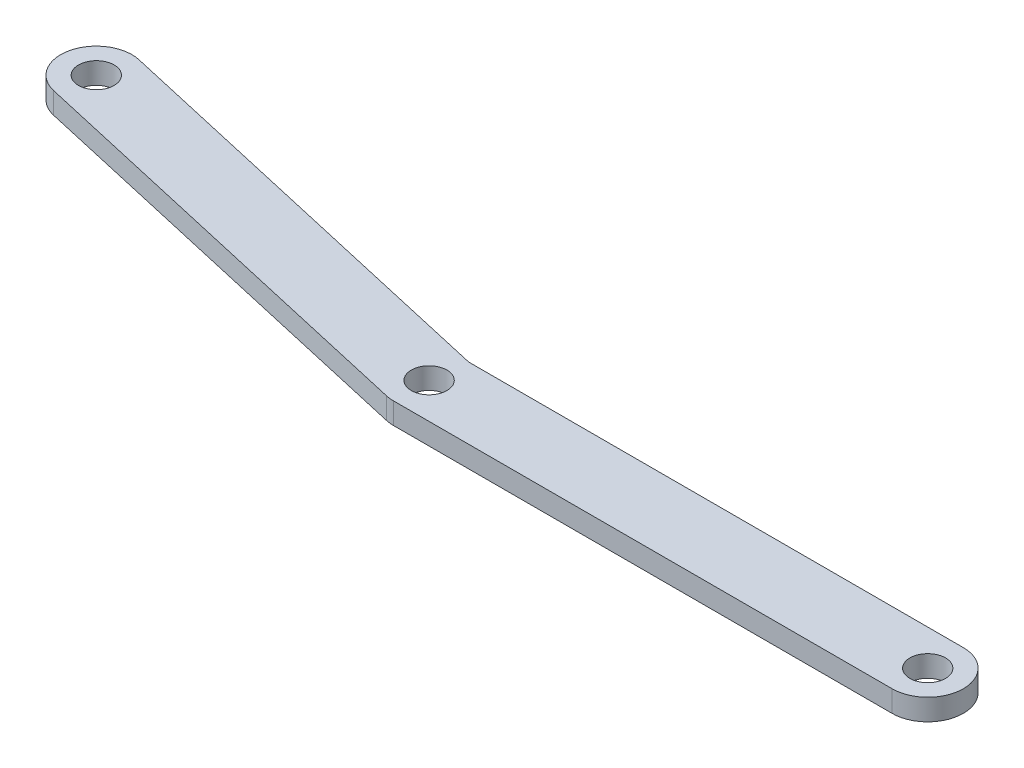
from build123d import *

# Parameters (mm, degrees)
SKETCH2_R               = 3.175
BOSS_EXTRUDE2_DEPTH     = 3.81
SKETCH1_R               = 3.175
BOSS_EXTRUDE3_DEPTH     = 3.81
CUT_EXTRUDE1_DEPTH      = 130.839106153
CUT_EXTRUDE1_DEPTH_BACK = 130.839106153
SKETCH3_R               = 3.175


with BuildPart() as part:
    # Sketch2 → Boss-Extrude2 (new body)
    with BuildSketch(Plane(origin=(0, 0, 0), x_dir=(1, 0, 0), z_dir=(0, 1, 0))):
        with BuildLine():
            Line((-45.85683296, -6.1921984), (-122.640093118, 11.252530303))
            ThreePointArc((-122.640093118, 11.252530303), (-127.425458558, 18.851561662), (-119.826427198, 23.636927102))
            Line((-119.826427198, 23.636927102), (-43.04316704, 6.1921984))
            ThreePointArc((-43.04316704, 6.1921984), (-38.2578016, -1.40683296), (-45.85683296, -6.1921984))
        make_face()
        with Locations(Location((-121.233260158, 17.444728703, 0), (0, 0, 90))):
            Circle(SKETCH2_R, mode=Mode.SUBTRACT)
    extrude(amount=BOSS_EXTRUDE2_DEPTH)

    # Sketch1 → Boss-Extrude3 (add)
    with BuildSketch(Plane(origin=(0, 0, 0), x_dir=(1, 0, 0), z_dir=(0, 1, 0))):
        with BuildLine():
            Line((-44.45, 6.35), (44.45, 6.35))
            ThreePointArc((44.45, 6.35), (50.8, 0), (44.45, -6.35))
            Line((44.45, -6.35), (-44.45, -6.35))
            ThreePointArc((-44.45, -6.35), (-50.8, 0), (-44.45, 6.35))
        make_face()
        with Locations(Location((44.45, 0, 0), (0, 0, 90))):
            Circle(SKETCH1_R, mode=Mode.SUBTRACT)
    extrude(amount=BOSS_EXTRUDE3_DEPTH)

    # Sketch3 → Cut-Extrude1 (cut, two sides: drawn at the far end of the back side and taken through both)
    with BuildSketch(Plane(origin=(0, 3.81, 0), x_dir=(1, 0, 0), z_dir=(0, 1, 0)).offset(-CUT_EXTRUDE1_DEPTH_BACK)):
        with Locations(Location((-44.45, 0, 0), (0, 0, 270))):
            Circle(SKETCH3_R)
    extrude(amount=CUT_EXTRUDE1_DEPTH + CUT_EXTRUDE1_DEPTH_BACK, mode=Mode.SUBTRACT)


solid = part.part
